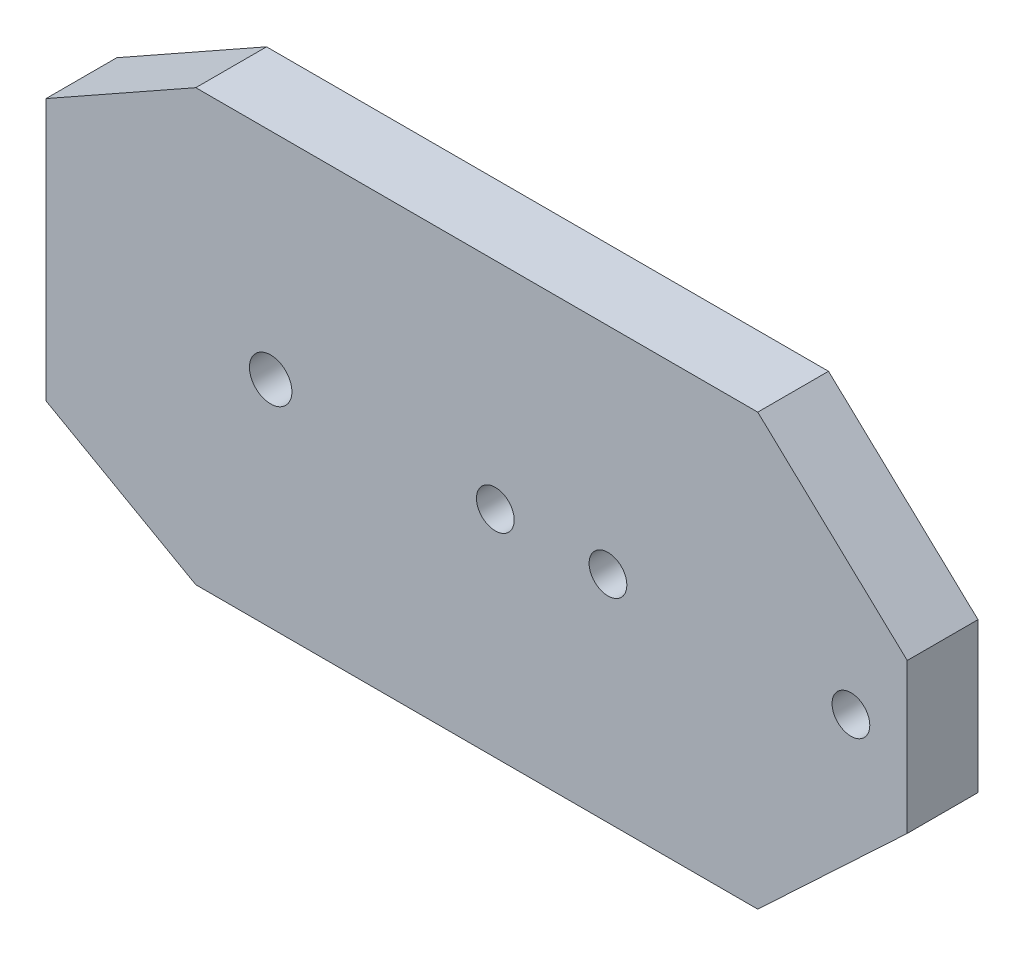
from build123d import *

# Parameters (mm, degrees)
SKETCH1_R           = 1.6
SKETCH1_R_2         = 1.8
BOSS_EXTRUDE1_DEPTH = 6


with BuildPart() as part:
    # Sketch1 → Boss-Extrude1 (new body)
    with BuildSketch(Plane.XY):
        Polygon((-19.05, -11.1), (-6.35, -18.25), (41.3, -18.25), (53.975, -6.35), (53.975, 6.35), (41.3, 18.25), (-6.35, 18.25), (-19.05, 11.1), align=None)
        with Locations((19.05, 0)):
            Circle(SKETCH1_R, mode=Mode.SUBTRACT)
        with Locations((28.6, 0)):
            Circle(SKETCH1_R, mode=Mode.SUBTRACT)
        with Locations((49.2, 0)):
            Circle(SKETCH1_R, mode=Mode.SUBTRACT)
        Circle(SKETCH1_R_2, mode=Mode.SUBTRACT)
    extrude(amount=BOSS_EXTRUDE1_DEPTH)


solid = part.part
